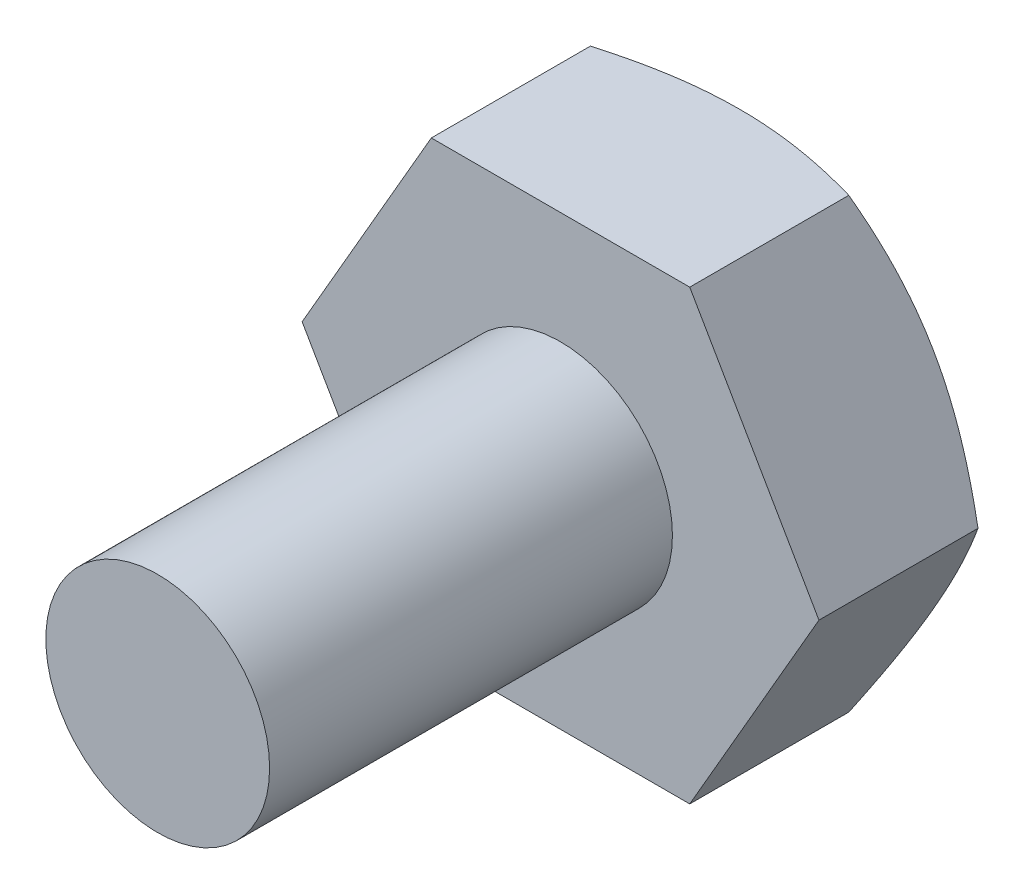
from build123d import *

# Parameters (mm, degrees)
Y_KSEKLIK_EKSTR_ZYON1_DEPTH = 4
IZIM2_R                     = 2.5
Y_KSEKLIK_EKSTR_ZYON2_DEPTH = 9
IZIM3_OUTSIDE_W             = 52.2
IZIM3_OUTSIDE_H             = 50.652
IZIM3_OUTSIDE_R             = 5
KES_EKSTR_ZYON1_DEPTH       = 10
KES_EKSTR_ZYON1_DRAFT       = -60


with BuildPart() as part:
    # Çizim1 → Yükseklik-Ekstrüzyon1 (new body)
    with BuildSketch(Plane.XY):
        Polygon((5.773502692, 0), (2.886751346, 5), (-2.886751346, 5), (-5.773502692, 0), (-2.886751346, -5), (2.886751346, -5), align=None)
    extrude(amount=Y_KSEKLIK_EKSTR_ZYON1_DEPTH)

    # Çizim2 → Yükseklik-Ekstrüzyon2 (add)
    with BuildSketch(Plane.XY.offset(4)):
        Circle(IZIM2_R)
    extrude(amount=Y_KSEKLIK_EKSTR_ZYON2_DEPTH)


with BuildPart() as kes_ekstr_zyon1_tool:
    # Çizim3 outside → Kes-Ekstrüzyon1 (with draft: the straight prism first)
    with BuildSketch(Plane(origin=(0, 0, 0), x_dir=(-1, 0, 0), z_dir=(0, 0, -1))):
        Rectangle(IZIM3_OUTSIDE_W, IZIM3_OUTSIDE_H)
        Circle(IZIM3_OUTSIDE_R, mode=Mode.SUBTRACT)
    extrude(amount=-KES_EKSTR_ZYON1_DEPTH)
    # Kes-Ekstrüzyon1: the draft: its side faces are tilted about the plane it starts from
    kes_ekstr_zyon1_sides = [kes_ekstr_zyon1_tool.faces().sort_by_distance(p)[0] for p in [
        (0, -25.326, 5),
        (-26.1, 0, 5),
        (0, 25.326, 5),
        (26.1, 0, 5),
        (5, 0, 5),
    ]]
    draft(kes_ekstr_zyon1_sides, Plane(origin=(0, 0, 0), x_dir=(-1, 0, 0), z_dir=(0, 0, -1)), KES_EKSTR_ZYON1_DRAFT)


with BuildPart() as part_1:
    add(part.part)

    # Kes-Ekstrüzyon1: cut by kes_ekstr_zyon1_tool
    add(kes_ekstr_zyon1_tool.part, mode=Mode.SUBTRACT)


solid = part_1.part
